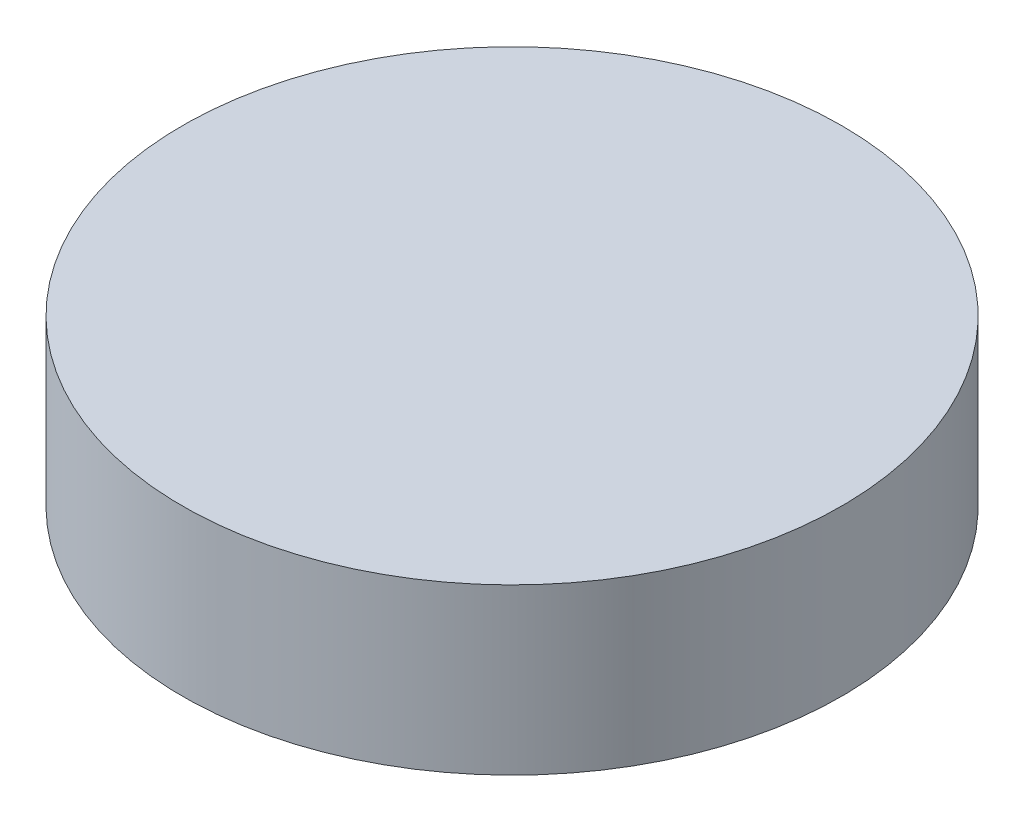
from build123d import *

# Parameters (mm, degrees)
SKETCH_1_W = 16
SKETCH_1_H = 8


with BuildPart() as part:
    # 草图1 → Revolve 2 (revolve)
    with BuildSketch(Plane.XY, mode=Mode.PRIVATE) as revolve_2_sk:
        with Locations((8, 4)):
            Rectangle(SKETCH_1_W, SKETCH_1_H)
    revolve(revolve_2_sk.sketch.rotate(Axis((0, 0, 0), (0, 1, 0)), 90), axis=Axis((0, 0, 0), (0, 1, 0)))


solid = part.part
